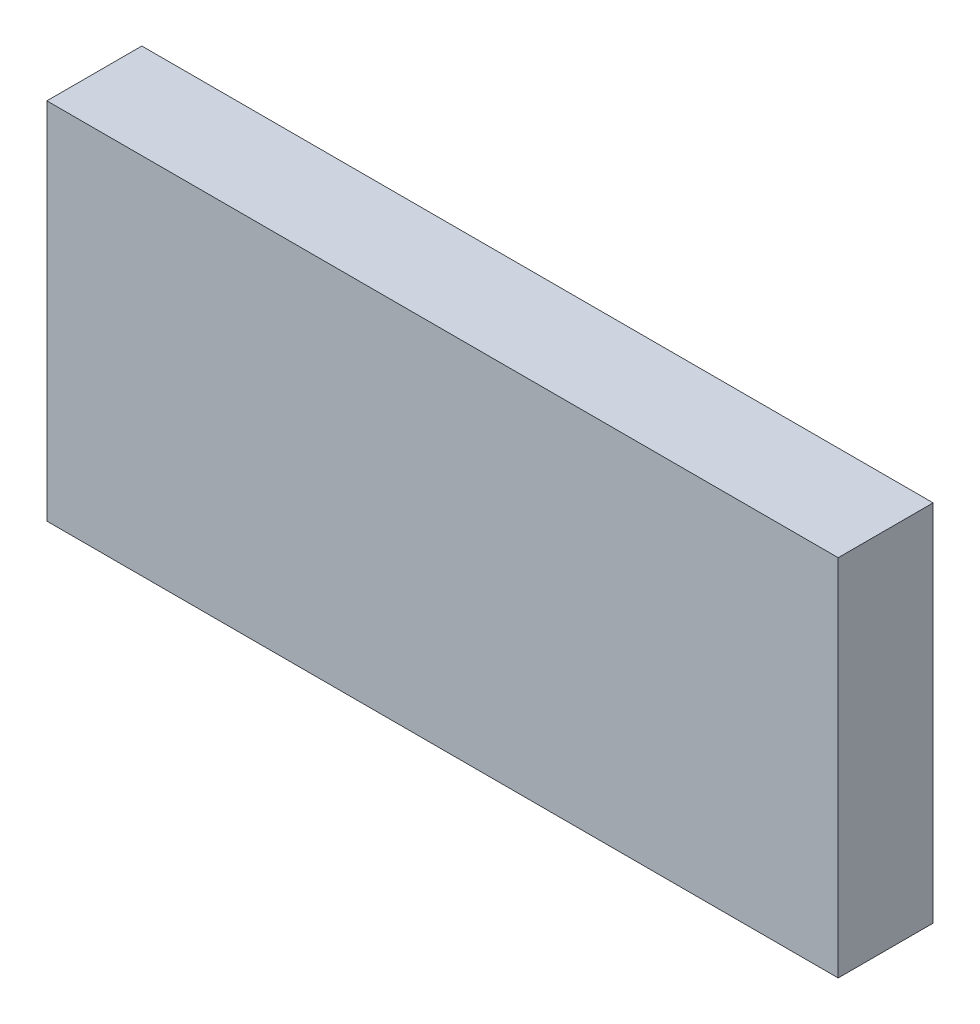
from build123d import *

# Parameters (mm, degrees)
ESQUISSE1_W        = 50
ESQUISSE1_H        = 23
BOSS_EXTRU_1_DEPTH = 6


with BuildPart() as part:
    # Esquisse1 → Boss.-Extru.1 (new body)
    with BuildSketch(Plane.XY):
        with Locations((-25, 11.5)):
            Rectangle(ESQUISSE1_W, ESQUISSE1_H)
    extrude(amount=BOSS_EXTRU_1_DEPTH)


solid = part.part
